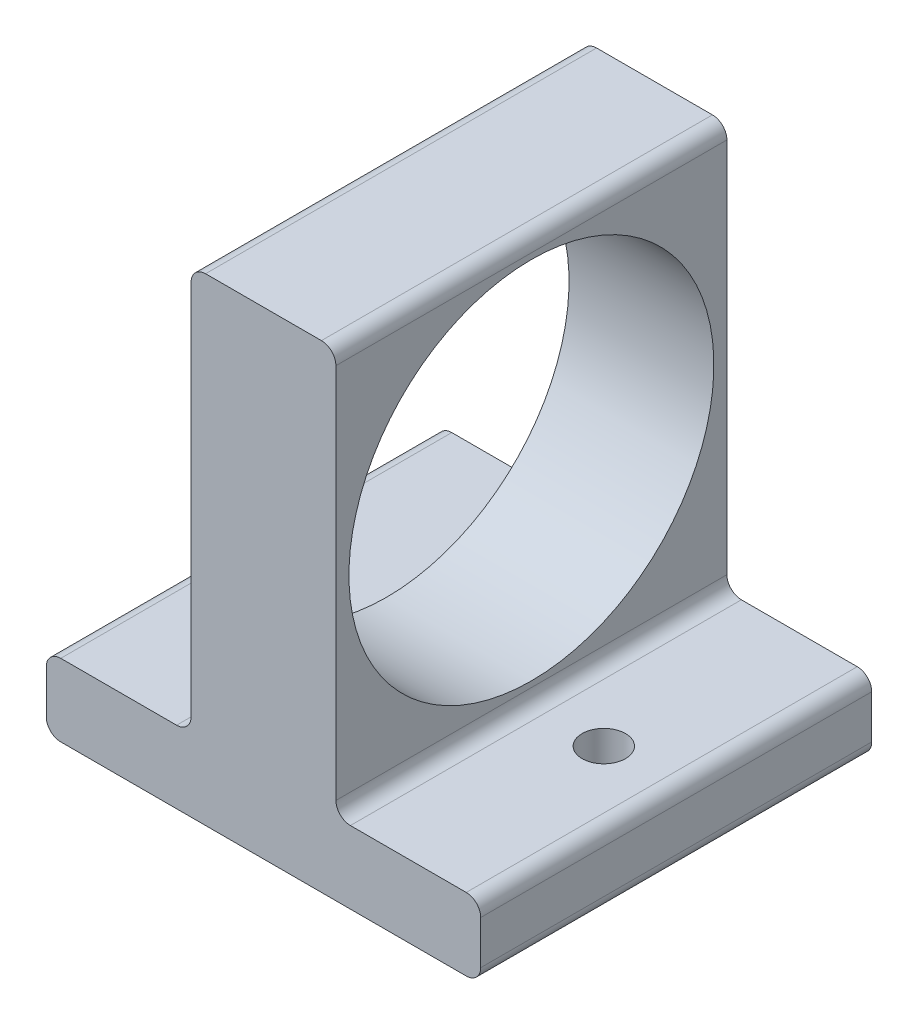
from build123d import *

# Parameters (mm, degrees)
BOSS_EXTRUDE1_DEPTH = 27
CUT_EXTRUDE1_REACH  = 45.738
SKETCH2_R           = 12.6
CUT_EXTRUDE2_REACH  = 47.2
SKETCH3_R           = 1.5


with BuildPart() as part:
    # Sketch1 → Boss-Extrude1 (new body)
    with BuildSketch(Plane.XY):
        with BuildLine():
            Line((-14, 0), (-6, 0))
            ThreePointArc((-6, 0), (-5.292893219, 0.292893219), (-5, 1))
            Line((-5, 1), (-5, 27))
            ThreePointArc((-5, 27), (-4.707106781, 27.707106781), (-4, 28))
            Line((-4, 28), (4, 28))
            ThreePointArc((4, 28), (4.707106781, 27.707106781), (5, 27))
            Line((5, 27), (5, 1))
            ThreePointArc((5, 1), (5.292893219, 0.292893219), (6, 0))
            Line((6, 0), (14, 0))
            ThreePointArc((14, 0), (14.707106781, -0.292893219), (15, -1))
            Line((15, -1), (15, -4))
            ThreePointArc((15, -4), (14.707106781, -4.707106781), (14, -5))
            Line((14, -5), (-14, -5))
            ThreePointArc((-14, -5), (-14.707106781, -4.707106781), (-15, -4))
            Line((-15, -4), (-15, -1))
            ThreePointArc((-15, -1), (-14.707106781, -0.292893219), (-14, 0))
        make_face()
    extrude(amount=BOSS_EXTRUDE1_DEPTH)

    # Sketch2 → Cut-Extrude1 (cut, up to next)
    with BuildSketch(Plane(origin=(5, 0, 0), x_dir=(0, 0, -1), z_dir=(1, 0, 0)), mode=Mode.PRIVATE) as cut_extrude1_sk1:
        with Locations(Location((-13.5, 14, 0), (0, 0, 90))):
            Circle(SKETCH2_R)
    cut_extrude1_tool1 = extrude(cut_extrude1_sk1.sketch, amount=-CUT_EXTRUDE1_REACH, mode=Mode.PRIVATE) & part.part
    add(cut_extrude1_tool1.solids().sort_by_distance((5, 14, 13.5))[0], mode=Mode.SUBTRACT)

    # Sketch3 → Cut-Extrude2 (cut, up to next)
    with BuildSketch(Plane.XZ.offset(5), mode=Mode.PRIVATE) as cut_extrude2_sk1:
        with Locations((-10, 13.5)):
            Circle(SKETCH3_R)
    cut_extrude2_tool1 = extrude(cut_extrude2_sk1.sketch, amount=-CUT_EXTRUDE2_REACH, mode=Mode.PRIVATE) & part.part
    # Sketch3 → Cut-Extrude2 (cut, up to next)
    with BuildSketch(Plane.XZ.offset(5), mode=Mode.PRIVATE) as cut_extrude2_sk2:
        with Locations(Location((10, 13.5, 0), (0, 0, 270))):
            Circle(SKETCH3_R)
    cut_extrude2_tool2 = extrude(cut_extrude2_sk2.sketch, amount=-CUT_EXTRUDE2_REACH, mode=Mode.PRIVATE) & part.part
    add(cut_extrude2_tool1.solids().sort_by_distance((-10, -5, 13.5))[0], mode=Mode.SUBTRACT)
    add(cut_extrude2_tool2.solids().sort_by_distance((10, -5, 13.5))[0], mode=Mode.SUBTRACT)


solid = part.part
